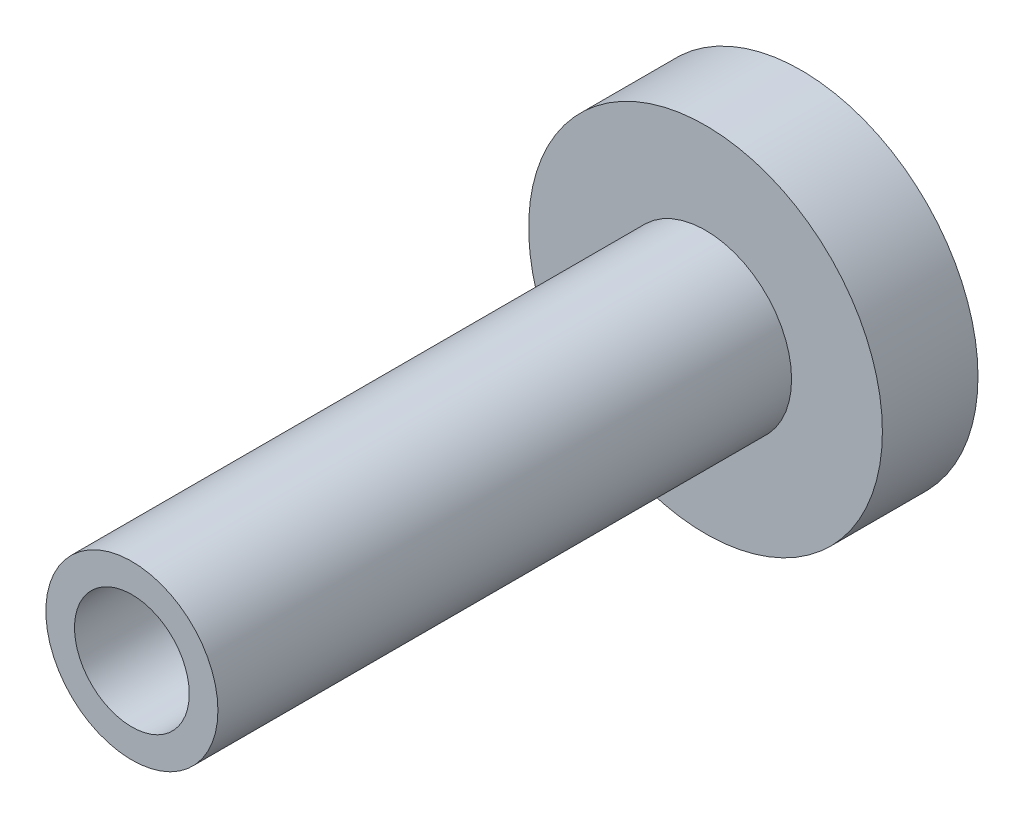
from build123d import *

# Parameters (mm, degrees)
CROQUIS1_R              = 9.25
SALIENTE_EXTRUIR1_DEPTH = 5
CROQUIS1_6_R            = 4.5
CROQUIS1_6_R_2          = 3
EXTRUIR_L_MINA1_DEPTH   = 35


with BuildPart() as part:
    # Croquis1 → Saliente-Extruir1 (new body)
    with BuildSketch(Plane.XY):
        Circle(CROQUIS1_R)
    extrude(amount=SALIENTE_EXTRUIR1_DEPTH)

    # Croquis1<6> → Extruir-Lámina1 (add)
    with BuildSketch(Plane.XY):
        Circle(CROQUIS1_6_R)
        Circle(CROQUIS1_6_R_2, mode=Mode.SUBTRACT)
    extrude(amount=EXTRUIR_L_MINA1_DEPTH)


solid = part.part
